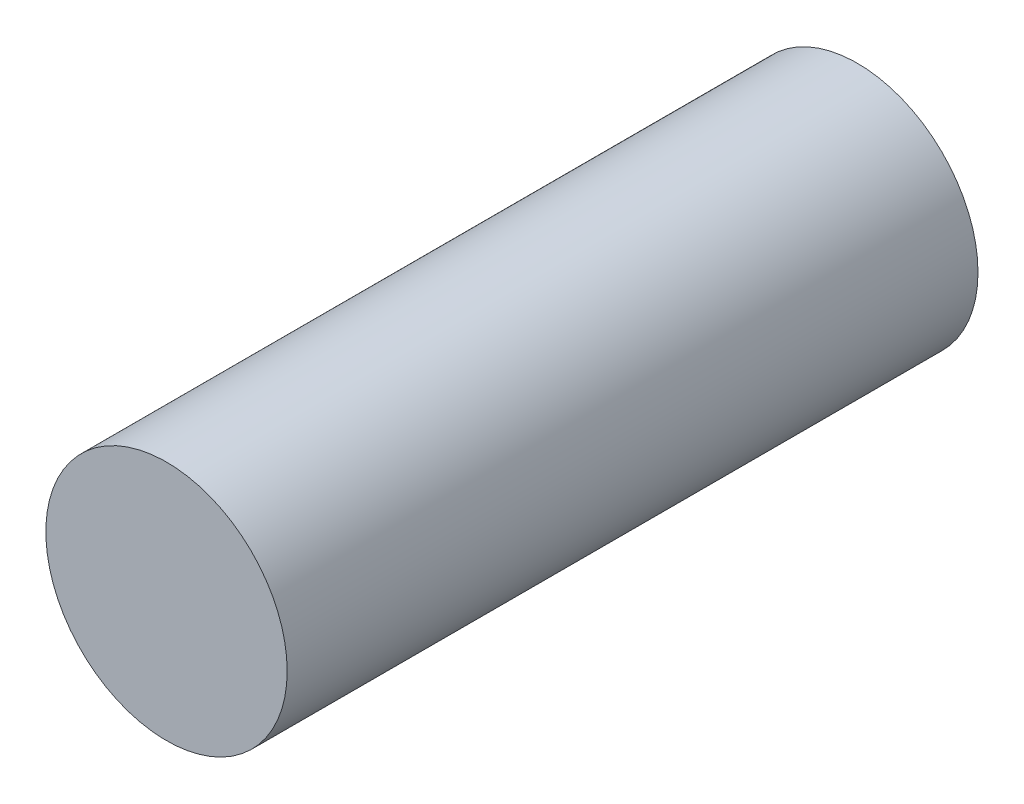
from build123d import *

# Parameters (mm, degrees)
SKETCH1_R           = 3
BOSS_EXTRUDE1_DEPTH = 17.175


with BuildPart() as part:
    # Sketch1 → Boss-Extrude1 (new body)
    with BuildSketch(Plane.XY):
        Circle(SKETCH1_R)
    extrude(amount=BOSS_EXTRUDE1_DEPTH)


solid = part.part
